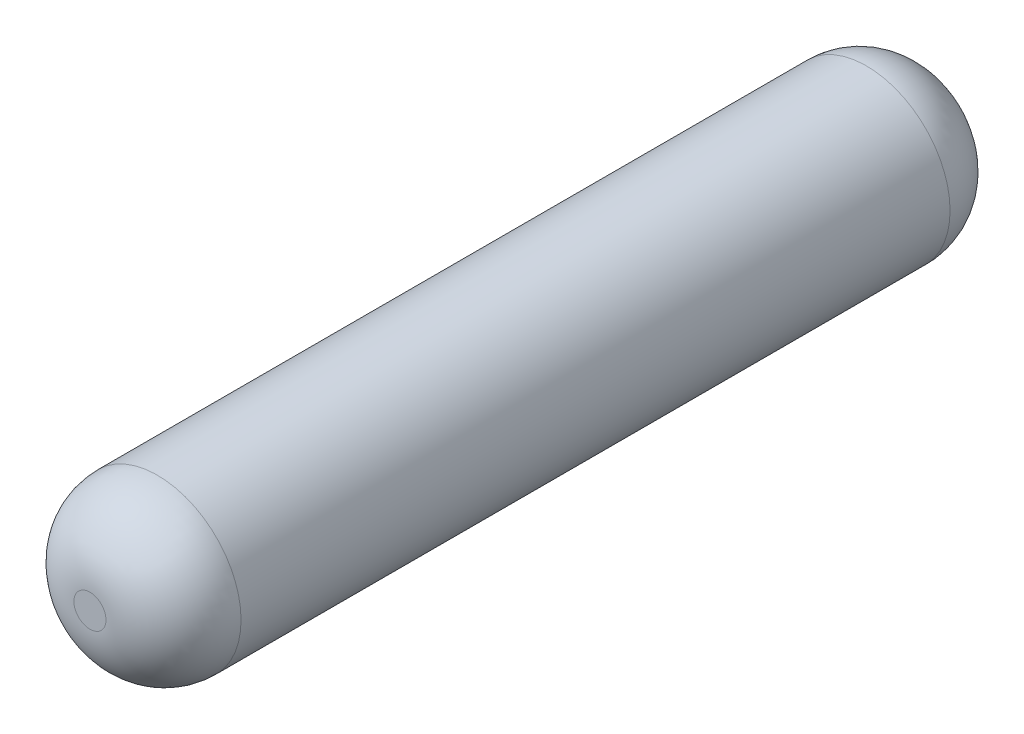
from build123d import *

# Parameters (mm, degrees)
SKETCH1_R           = 2.475
BOSS_EXTRUDE1_DEPTH = 25
FILLET1_R           = 2


with BuildPart() as part:
    # Sketch1 → Boss-Extrude1 (new body)
    with BuildSketch(Plane.XY):
        Circle(SKETCH1_R)
    extrude(amount=BOSS_EXTRUDE1_DEPTH)

    # Fillet1
    fillet1_edges = [part.edges().sort_by_distance(p)[0] for p in [
        (-2.475, 0, 0),
        (-2.475, 0, 25),
    ]]
    fillet(fillet1_edges, radius=FILLET1_R)


solid = part.part
